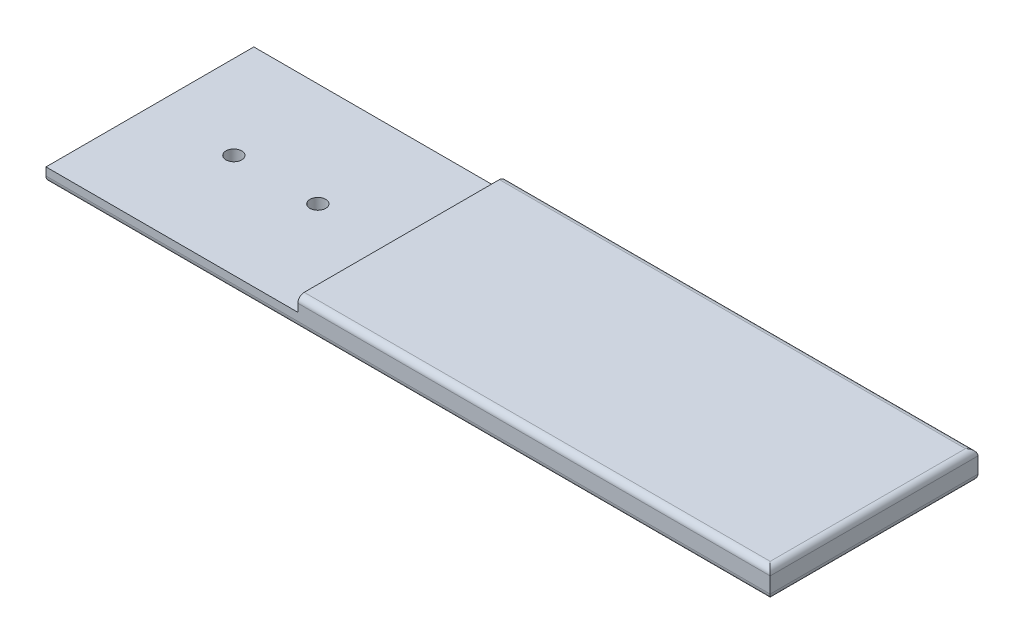
from build123d import *

# Parameters (mm, degrees)
SKETCH1_W             = 230
SKETCH1_H             = 66
BOSS_EXTRUDE1_DEPTH   = 4.5
SKETCH11_W            = 150
SKETCH11_H            = 66
BOSS_EXTRUDE2_DEPTH   = 4.5
F_5_0MM_DOWEL_HOLE1_D = 5
FILLET1_R             = 2


with BuildPart() as part:
    # Sketch1 → Boss-Extrude1 (new body)
    with BuildSketch(Plane(origin=(0, 0, 0), x_dir=(1, 0, 0), z_dir=(0, 1, 0))):
        with Locations((82.410138249, 12.451612903)):
            Rectangle(SKETCH1_W, SKETCH1_H)
    extrude(amount=BOSS_EXTRUDE1_DEPTH)

    # Sketch11 → Boss-Extrude2 (add)
    with BuildSketch(Plane(origin=(0, 4.5, 0), x_dir=(1, 0, 0), z_dir=(0, 1, 0))):
        with Locations((122.410138249, 12.451612903)):
            Rectangle(SKETCH11_W, SKETCH11_H)
    extrude(amount=BOSS_EXTRUDE2_DEPTH)

    # Ø5.0mm Dowel Hole1 (through all)
    with Locations(Plane(origin=(0, 0, 0), x_dir=(-1, 0, 0), z_dir=(0, -1, 0))):
        with Locations((5.923195084, 12.451612903), (-20.743471582, 12.451612903)):
            Hole(F_5_0MM_DOWEL_HOLE1_D / 2)

    # Fillet1
    fillet1_edges = [part.edges().sort_by_distance(p)[0] for p in [
        (122.410138249, 9, -45.451612903),
        (122.410138249, 9, 20.548387097),
        (197.410138249, 9, -12.451612903),
        (82.410138249, 0, -45.451612903),
        (197.410138249, 0, -12.451612903),
        (82.410138249, 0, 20.548387097),
    ]]
    fillet(fillet1_edges, radius=FILLET1_R)


solid = part.part
